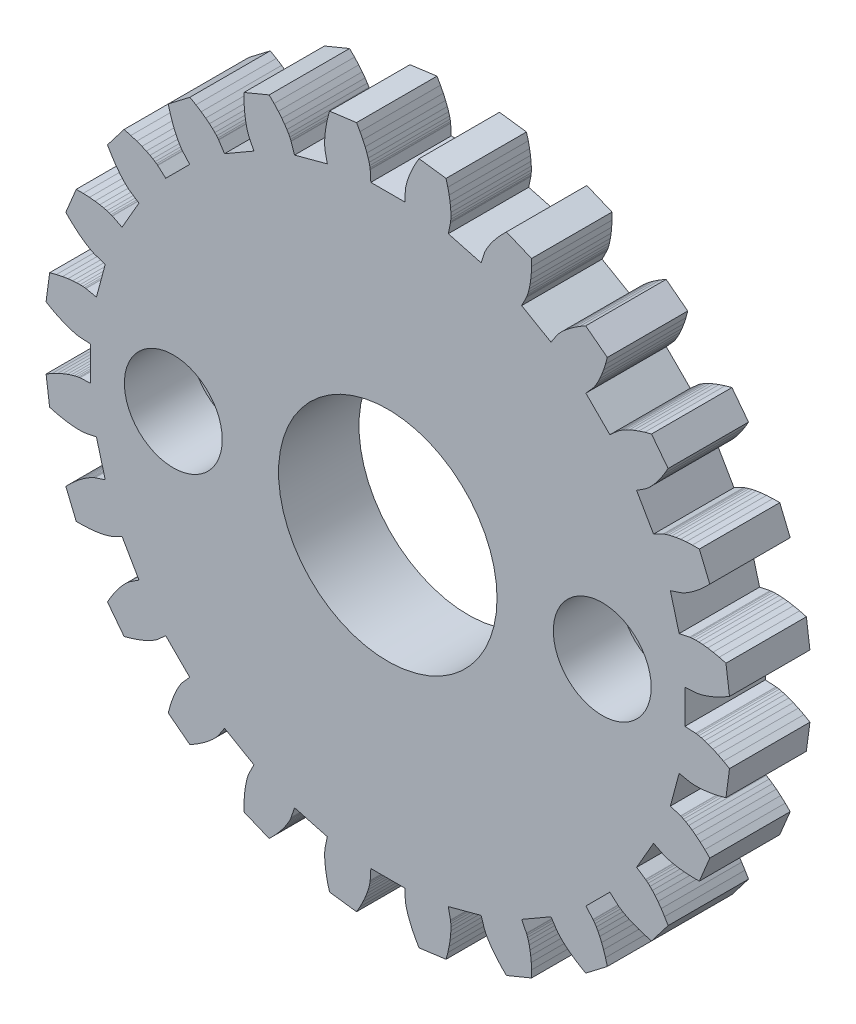
from build123d import *

# Parameters (mm, degrees)
MAIN_GEAR_BODY_DEPTH      = 3
SKETCH1_R                 = 4.075
SKETCH1_R_2               = 1.15
SERVO_CLEARANCE_DEPTH     = 19.274620546
SKETCH2_R                 = 1.825
BOLT_HEAD_CLEARANCE_DEPTH = 2.5


with BuildPart() as part:
    # Model → Main Gear Body (new body)
    with BuildSketch(Plane.XY):
        Polygon((11.481280763, -0.655890262), (11.081931867, -0.633076687), (11.081931867, 0.633076687), (11.481280763, 0.655890262), (11.494959484, 0.657119822), (11.535795525, 0.662587053), (11.603342457, 0.674939875), (11.696960474, 0.69678954), (11.81581907, 0.730698092), (11.958900465, 0.779166001), (12.125003794, 0.844620031), (12.312750022, 0.929401369), (12.520587586, 1.035754071), (12.746798737, 1.165813859), (12.614196933, 2.173024562), (12.36203179, 2.240104916), (12.133750014, 2.289041418), (11.930458058, 2.322341602), (11.753073814, 2.342574636), (11.602323381, 2.352358851), (11.478738615, 2.354349128), (11.382655444, 2.351224158), (11.314212973, 2.345673635), (11.273353363, 2.34038543), (11.259822499, 2.338032781), (10.868176499, 2.256709902), (10.540471892, 3.479720146), (10.920308717, 3.605115467), (10.933203113, 3.609843444), (10.971232676, 3.625693529), (11.033280856, 3.655107871), (11.118053808, 3.700443153), (11.224086216, 3.763959167), (11.349747813, 3.847807762), (11.493250558, 3.954022205), (11.652656464, 4.084506989), (11.82588603, 4.24102813), (12.010727273, 4.425203993), (11.621958453, 5.36377495), (11.361023956, 5.363304455), (11.127854994, 5.351489815), (10.922871322, 5.331039494), (10.746294605, 5.304672682), (10.598148527, 5.275106425), (10.478259688, 5.245042794), (10.386259274, 5.21715615), (10.321585504, 5.194080542), (10.28348684, 5.178397283), (10.27102594, 5.172622753), (9.913772864, 4.99270544), (9.280696176, 6.089226427), (9.615135678, 6.30865801), (9.626367017, 6.316562201), (9.658998451, 6.341714983), (9.711319399, 6.386186306), (9.781470148, 6.45191768), (9.867450435, 6.540712645), (9.967128604, 6.654227783), (10.078251291, 6.7939643), (10.198453625, 6.961260207), (10.325269884, 7.157283131), (10.456144594, 7.383023787), (9.837702711, 8.18899294), (9.585781114, 8.121003659), (9.363615046, 8.049243025), (9.170908956, 7.976435853), (9.007173178, 7.905266052), (8.871727365, 7.838364214), (8.76370468, 7.778295462), (8.682056698, 7.727547573), (8.625559041, 7.688519444), (8.592817683, 7.663509918), (8.582275936, 7.654707033), (8.28376199, 7.388456353), (7.388456353, 8.28376199), (7.654707033, 8.582275936), (7.663509918, 8.592817683), (7.688519444, 8.625559041), (7.727547573, 8.682056698), (7.778295462, 8.76370468), (7.838364214, 8.871727365), (7.905266052, 9.007173178), (7.976435853, 9.170908956), (8.049243025, 9.363615046), (8.121003659, 9.585781114), (8.18899294, 9.837702711), (7.383023787, 10.456144594), (7.157283131, 10.325269884), (6.961260207, 10.198453625), (6.7939643, 10.078251291), (6.654227783, 9.967128604), (6.540712645, 9.867450435), (6.45191768, 9.781470148), (6.386186306, 9.711319399), (6.341714983, 9.658998451), (6.316562201, 9.626367017), (6.30865801, 9.615135678), (6.089226427, 9.280696176), (4.99270544, 9.913772864), (5.172622753, 10.27102594), (5.178397283, 10.28348684), (5.194080542, 10.321585504), (5.21715615, 10.386259274), (5.245042794, 10.478259688), (5.275106425, 10.598148527), (5.304672682, 10.746294605), (5.331039494, 10.922871322), (5.351489815, 11.127854994), (5.363304455, 11.361023956), (5.36377495, 11.621958453), (4.425203993, 12.010727273), (4.24102813, 11.82588603), (4.084506989, 11.652656464), (3.954022205, 11.493250558), (3.847807762, 11.349747813), (3.763959167, 11.224086216), (3.700443153, 11.118053808), (3.655107871, 11.033280856), (3.625693529, 10.971232676), (3.609843444, 10.933203113), (3.605115467, 10.920308717), (3.479720146, 10.540471892), (2.256709902, 10.868176499), (2.338032781, 11.259822499), (2.34038543, 11.273353363), (2.345673635, 11.314212973), (2.351224158, 11.382655444), (2.354349128, 11.478738615), (2.352358851, 11.602323381), (2.342574636, 11.753073814), (2.322341602, 11.930458058), (2.289041418, 12.133750014), (2.240104916, 12.36203179), (2.173024562, 12.614196933), (1.165813859, 12.746798737), (1.035754071, 12.520587586), (0.929401369, 12.312750022), (0.844620031, 12.125003794), (0.779166001, 11.958900465), (0.730698092, 11.81581907), (0.69678954, 11.696960474), (0.674939875, 11.603342457), (0.662587053, 11.535795525), (0.657119822, 11.494959484), (0.655890262, 11.481280763), (0.633076687, 11.081931867), (-0.633076687, 11.081931867), (-0.655890262, 11.481280763), (-0.657119822, 11.494959484), (-0.662587053, 11.535795525), (-0.674939875, 11.603342457), (-0.69678954, 11.696960474), (-0.730698092, 11.81581907), (-0.779166001, 11.958900465), (-0.844620031, 12.125003794), (-0.929401369, 12.312750022), (-1.035754071, 12.520587586), (-1.165813859, 12.746798737), (-2.173024562, 12.614196933), (-2.240104916, 12.36203179), (-2.289041418, 12.133750014), (-2.322341602, 11.930458058), (-2.342574636, 11.753073814), (-2.352358851, 11.602323381), (-2.354349128, 11.478738615), (-2.351224158, 11.382655444), (-2.345673635, 11.314212973), (-2.34038543, 11.273353363), (-2.338032781, 11.259822499), (-2.256709902, 10.868176499), (-3.479720146, 10.540471892), (-3.605115467, 10.920308717), (-3.609843444, 10.933203113), (-3.625693529, 10.971232676), (-3.655107871, 11.033280856), (-3.700443153, 11.118053808), (-3.763959167, 11.224086216), (-3.847807762, 11.349747813), (-3.954022205, 11.493250558), (-4.084506989, 11.652656464), (-4.24102813, 11.82588603), (-4.425203993, 12.010727273), (-5.36377495, 11.621958453), (-5.363304455, 11.361023956), (-5.351489815, 11.127854994), (-5.331039494, 10.922871322), (-5.304672682, 10.746294605), (-5.275106425, 10.598148527), (-5.245042794, 10.478259688), (-5.21715615, 10.386259274), (-5.194080542, 10.321585504), (-5.178397283, 10.28348684), (-5.172622753, 10.27102594), (-4.99270544, 9.913772864), (-6.089226427, 9.280696176), (-6.30865801, 9.615135678), (-6.316562201, 9.626367017), (-6.341714983, 9.658998451), (-6.386186306, 9.711319399), (-6.45191768, 9.781470148), (-6.540712645, 9.867450435), (-6.654227783, 9.967128604), (-6.7939643, 10.078251291), (-6.961260207, 10.198453625), (-7.157283131, 10.325269884), (-7.383023787, 10.456144594), (-8.18899294, 9.837702711), (-8.121003659, 9.585781114), (-8.049243025, 9.363615046), (-7.976435853, 9.170908956), (-7.905266052, 9.007173178), (-7.838364214, 8.871727365), (-7.778295462, 8.76370468), (-7.727547573, 8.682056698), (-7.688519444, 8.625559041), (-7.663509918, 8.592817683), (-7.654707033, 8.582275936), (-7.388456353, 8.28376199), (-8.28376199, 7.388456353), (-8.582275936, 7.654707033), (-8.592817683, 7.663509918), (-8.625559041, 7.688519444), (-8.682056698, 7.727547573), (-8.76370468, 7.778295462), (-8.871727365, 7.838364214), (-9.007173178, 7.905266052), (-9.170908956, 7.976435853), (-9.363615046, 8.049243025), (-9.585781114, 8.121003659), (-9.837702711, 8.18899294), (-10.456144594, 7.383023787), (-10.325269884, 7.157283131), (-10.198453625, 6.961260207), (-10.078251291, 6.7939643), (-9.967128604, 6.654227783), (-9.867450435, 6.540712645), (-9.781470148, 6.45191768), (-9.711319399, 6.386186306), (-9.658998451, 6.341714983), (-9.626367017, 6.316562201), (-9.615135678, 6.30865801), (-9.280696176, 6.089226427), (-9.913772864, 4.99270544), (-10.27102594, 5.172622753), (-10.28348684, 5.178397283), (-10.321585504, 5.194080542), (-10.386259274, 5.21715615), (-10.478259688, 5.245042794), (-10.598148527, 5.275106425), (-10.746294605, 5.304672682), (-10.922871322, 5.331039494), (-11.127854994, 5.351489815), (-11.361023956, 5.363304455), (-11.621958453, 5.36377495), (-12.010727273, 4.425203993), (-11.82588603, 4.24102813), (-11.652656464, 4.084506989), (-11.493250558, 3.954022205), (-11.349747813, 3.847807762), (-11.224086216, 3.763959167), (-11.118053808, 3.700443153), (-11.033280856, 3.655107871), (-10.971232676, 3.625693529), (-10.933203113, 3.609843444), (-10.920308717, 3.605115467), (-10.540471892, 3.479720146), (-10.868176499, 2.256709902), (-11.259822499, 2.338032781), (-11.273353363, 2.34038543), (-11.314212973, 2.345673635), (-11.382655444, 2.351224158), (-11.478738615, 2.354349128), (-11.602323381, 2.352358851), (-11.753073814, 2.342574636), (-11.930458058, 2.322341602), (-12.133750014, 2.289041418), (-12.36203179, 2.240104916), (-12.614196933, 2.173024562), (-12.746798737, 1.165813859), (-12.520587586, 1.035754071), (-12.312750022, 0.929401369), (-12.125003794, 0.844620031), (-11.958900465, 0.779166001), (-11.81581907, 0.730698092), (-11.696960474, 0.69678954), (-11.603342457, 0.674939875), (-11.535795525, 0.662587053), (-11.494959484, 0.657119822), (-11.481280763, 0.655890262), (-11.081931867, 0.633076687), (-11.081931867, -0.633076687), (-11.481280763, -0.655890262), (-11.494959484, -0.657119822), (-11.535795525, -0.662587053), (-11.603342457, -0.674939875), (-11.696960474, -0.69678954), (-11.81581907, -0.730698092), (-11.958900465, -0.779166001), (-12.125003794, -0.844620031), (-12.312750022, -0.929401369), (-12.520587586, -1.035754071), (-12.746798737, -1.165813859), (-12.614196933, -2.173024562), (-12.36203179, -2.240104916), (-12.133750014, -2.289041418), (-11.930458058, -2.322341602), (-11.753073814, -2.342574636), (-11.602323381, -2.352358851), (-11.478738615, -2.354349128), (-11.382655444, -2.351224158), (-11.314212973, -2.345673635), (-11.273353363, -2.34038543), (-11.259822499, -2.338032781), (-10.868176499, -2.256709902), (-10.540471892, -3.479720146), (-10.920308717, -3.605115467), (-10.933203113, -3.609843444), (-10.971232676, -3.625693529), (-11.033280856, -3.655107871), (-11.118053808, -3.700443153), (-11.224086216, -3.763959167), (-11.349747813, -3.847807762), (-11.493250558, -3.954022205), (-11.652656464, -4.084506989), (-11.82588603, -4.24102813), (-12.010727273, -4.425203993), (-11.621958453, -5.36377495), (-11.361023956, -5.363304455), (-11.127854994, -5.351489815), (-10.922871322, -5.331039494), (-10.746294605, -5.304672682), (-10.598148527, -5.275106425), (-10.478259688, -5.245042794), (-10.386259274, -5.21715615), (-10.321585504, -5.194080542), (-10.28348684, -5.178397283), (-10.27102594, -5.172622753), (-9.913772864, -4.99270544), (-9.280696176, -6.089226427), (-9.615135678, -6.30865801), (-9.626367017, -6.316562201), (-9.658998451, -6.341714983), (-9.711319399, -6.386186306), (-9.781470148, -6.45191768), (-9.867450435, -6.540712645), (-9.967128604, -6.654227783), (-10.078251291, -6.7939643), (-10.198453625, -6.961260207), (-10.325269884, -7.157283131), (-10.456144594, -7.383023787), (-9.837702711, -8.18899294), (-9.585781114, -8.121003659), (-9.363615046, -8.049243025), (-9.170908956, -7.976435853), (-9.007173178, -7.905266052), (-8.871727365, -7.838364214), (-8.76370468, -7.778295462), (-8.682056698, -7.727547573), (-8.625559041, -7.688519444), (-8.592817683, -7.663509918), (-8.582275936, -7.654707033), (-8.28376199, -7.388456353), (-7.388456353, -8.28376199), (-7.654707033, -8.582275936), (-7.663509918, -8.592817683), (-7.688519444, -8.625559041), (-7.727547573, -8.682056698), (-7.778295462, -8.76370468), (-7.838364214, -8.871727365), (-7.905266052, -9.007173178), (-7.976435853, -9.170908956), (-8.049243025, -9.363615046), (-8.121003659, -9.585781114), (-8.18899294, -9.837702711), (-7.383023787, -10.456144594), (-7.157283131, -10.325269884), (-6.961260207, -10.198453625), (-6.7939643, -10.078251291), (-6.654227783, -9.967128604), (-6.540712645, -9.867450435), (-6.45191768, -9.781470148), (-6.386186306, -9.711319399), (-6.341714983, -9.658998451), (-6.316562201, -9.626367017), (-6.30865801, -9.615135678), (-6.089226427, -9.280696176), (-4.99270544, -9.913772864), (-5.172622753, -10.27102594), (-5.178397283, -10.28348684), (-5.194080542, -10.321585504), (-5.21715615, -10.386259274), (-5.245042794, -10.478259688), (-5.275106425, -10.598148527), (-5.304672682, -10.746294605), (-5.331039494, -10.922871322), (-5.351489815, -11.127854994), (-5.363304455, -11.361023956), (-5.36377495, -11.621958453), (-4.425203993, -12.010727273), (-4.24102813, -11.82588603), (-4.084506989, -11.652656464), (-3.954022205, -11.493250558), (-3.847807762, -11.349747813), (-3.763959167, -11.224086216), (-3.700443153, -11.118053808), (-3.655107871, -11.033280856), (-3.625693529, -10.971232676), (-3.609843444, -10.933203113), (-3.605115467, -10.920308717), (-3.479720146, -10.540471892), (-2.256709902, -10.868176499), (-2.338032781, -11.259822499), (-2.34038543, -11.273353363), (-2.345673635, -11.314212973), (-2.351224158, -11.382655444), (-2.354349128, -11.478738615), (-2.352358851, -11.602323381), (-2.342574636, -11.753073814), (-2.322341602, -11.930458058), (-2.289041418, -12.133750014), (-2.240104916, -12.36203179), (-2.173024562, -12.614196933), (-1.165813859, -12.746798737), (-1.035754071, -12.520587586), (-0.929401369, -12.312750022), (-0.844620031, -12.125003794), (-0.779166001, -11.958900465), (-0.730698092, -11.81581907), (-0.69678954, -11.696960474), (-0.674939875, -11.603342457), (-0.662587053, -11.535795525), (-0.657119822, -11.494959484), (-0.655890262, -11.481280763), (-0.633076687, -11.081931867), (0.633076687, -11.081931867), (0.655890262, -11.481280763), (0.657119822, -11.494959484), (0.662587053, -11.535795525), (0.674939875, -11.603342457), (0.69678954, -11.696960474), (0.730698092, -11.81581907), (0.779166001, -11.958900465), (0.844620031, -12.125003794), (0.929401369, -12.312750022), (1.035754071, -12.520587586), (1.165813859, -12.746798737), (2.173024562, -12.614196933), (2.240104916, -12.36203179), (2.289041418, -12.133750014), (2.322341602, -11.930458058), (2.342574636, -11.753073814), (2.352358851, -11.602323381), (2.354349128, -11.478738615), (2.351224158, -11.382655444), (2.345673635, -11.314212973), (2.34038543, -11.273353363), (2.338032781, -11.259822499), (2.256709902, -10.868176499), (3.479720146, -10.540471892), (3.605115467, -10.920308717), (3.609843444, -10.933203113), (3.625693529, -10.971232676), (3.655107871, -11.033280856), (3.700443153, -11.118053808), (3.763959167, -11.224086216), (3.847807762, -11.349747813), (3.954022205, -11.493250558), (4.084506989, -11.652656464), (4.24102813, -11.82588603), (4.425203993, -12.010727273), (5.36377495, -11.621958453), (5.363304455, -11.361023956), (5.351489815, -11.127854994), (5.331039494, -10.922871322), (5.304672682, -10.746294605), (5.275106425, -10.598148527), (5.245042794, -10.478259688), (5.21715615, -10.386259274), (5.194080542, -10.321585504), (5.178397283, -10.28348684), (5.172622753, -10.27102594), (4.99270544, -9.913772864), (6.089226427, -9.280696176), (6.30865801, -9.615135678), (6.316562201, -9.626367017), (6.341714983, -9.658998451), (6.386186306, -9.711319399), (6.45191768, -9.781470148), (6.540712645, -9.867450435), (6.654227783, -9.967128604), (6.7939643, -10.078251291), (6.961260207, -10.198453625), (7.157283131, -10.325269884), (7.383023787, -10.456144594), (8.18899294, -9.837702711), (8.121003659, -9.585781114), (8.049243025, -9.363615046), (7.976435853, -9.170908956), (7.905266052, -9.007173178), (7.838364214, -8.871727365), (7.778295462, -8.76370468), (7.727547573, -8.682056698), (7.688519444, -8.625559041), (7.663509918, -8.592817683), (7.654707033, -8.582275936), (7.388456353, -8.28376199), (8.28376199, -7.388456353), (8.582275936, -7.654707033), (8.592817683, -7.663509918), (8.625559041, -7.688519444), (8.682056698, -7.727547573), (8.76370468, -7.778295462), (8.871727365, -7.838364214), (9.007173178, -7.905266052), (9.170908956, -7.976435853), (9.363615046, -8.049243025), (9.585781114, -8.121003659), (9.837702711, -8.18899294), (10.456144594, -7.383023787), (10.325269884, -7.157283131), (10.198453625, -6.961260207), (10.078251291, -6.7939643), (9.967128604, -6.654227783), (9.867450435, -6.540712645), (9.781470148, -6.45191768), (9.711319399, -6.386186306), (9.658998451, -6.341714983), (9.626367017, -6.316562201), (9.615135678, -6.30865801), (9.280696176, -6.089226427), (9.913772864, -4.99270544), (10.27102594, -5.172622753), (10.28348684, -5.178397283), (10.321585504, -5.194080542), (10.386259274, -5.21715615), (10.478259688, -5.245042794), (10.598148527, -5.275106425), (10.746294605, -5.304672682), (10.922871322, -5.331039494), (11.127854994, -5.351489815), (11.361023956, -5.363304455), (11.621958453, -5.36377495), (12.010727273, -4.425203993), (11.82588603, -4.24102813), (11.652656464, -4.084506989), (11.493250558, -3.954022205), (11.349747813, -3.847807762), (11.224086216, -3.763959167), (11.118053808, -3.700443153), (11.033280856, -3.655107871), (10.971232676, -3.625693529), (10.933203113, -3.609843444), (10.920308717, -3.605115467), (10.540471892, -3.479720146), (10.868176499, -2.256709902), (11.259822499, -2.338032781), (11.273353363, -2.34038543), (11.314212973, -2.345673635), (11.382655444, -2.351224158), (11.478738615, -2.354349128), (11.602323381, -2.352358851), (11.753073814, -2.342574636), (11.930458058, -2.322341602), (12.133750014, -2.289041418), (12.36203179, -2.240104916), (12.614196933, -2.173024562), (12.746798737, -1.165813859), (12.520587586, -1.035754071), (12.312750022, -0.929401369), (12.125003794, -0.844620031), (11.958900465, -0.779166001), (11.81581907, -0.730698092), (11.696960474, -0.69678954), (11.603342457, -0.674939875), (11.535795525, -0.662587053), (11.494959484, -0.657119822), align=None)
    extrude(amount=MAIN_GEAR_BODY_DEPTH)

    # Sketch1 → Servo Clearance (cut, through all)
    with BuildSketch(Plane.XY.offset(3)):
        Circle(SKETCH1_R)
        with Locations((-8, 0)):
            Circle(SKETCH1_R_2)
        with Locations((8, 0)):
            Circle(SKETCH1_R_2)
    extrude(amount=-SERVO_CLEARANCE_DEPTH, mode=Mode.SUBTRACT)

    # Sketch2 → Bolt Head Clearance (cut)
    with BuildSketch(Plane.XY.offset(3)):
        with Locations((8, 0)):
            Circle(SKETCH2_R)
        with Locations((-8, 0)):
            Circle(SKETCH2_R)
    extrude(amount=-BOLT_HEAD_CLEARANCE_DEPTH, mode=Mode.SUBTRACT)


solid = part.part
